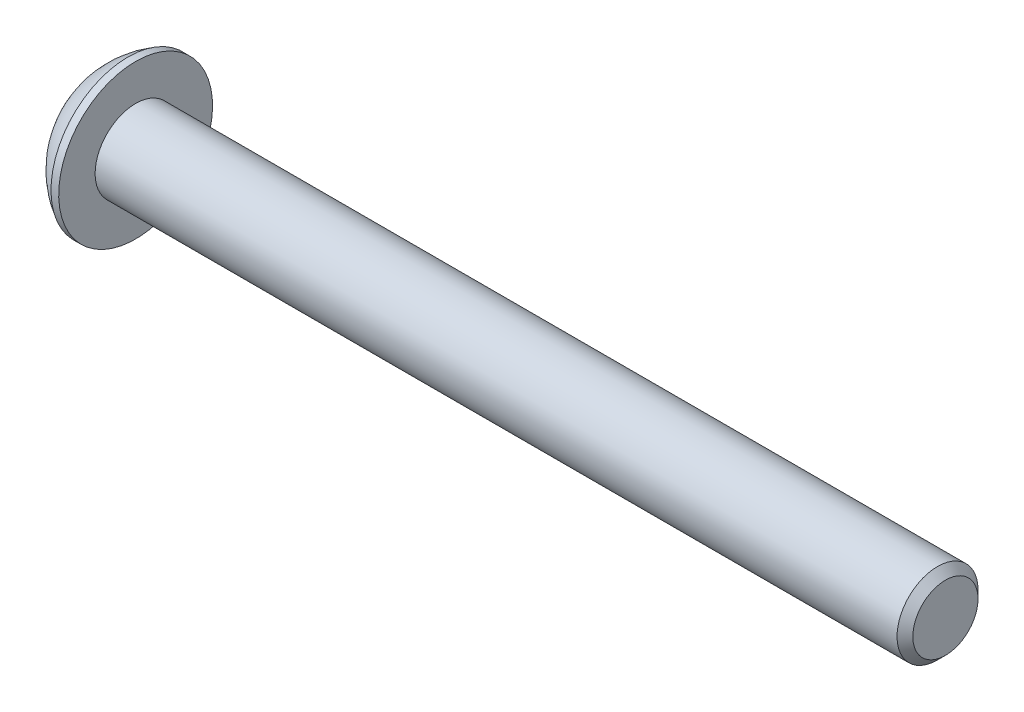
from build123d import *

# Parameters (mm, degrees)
CUT_EXTRUDE1_DEPTH = 1.5


with BuildPart() as part:
    # Sketch1 → Revolve1 (revolve)
    with BuildSketch(Plane.XY):
        with BuildLine():
            Line((42.2, 0), (42.2, 1.61))
            Line((42.2, 1.61), (41.81, 2))
            Line((41.81, 2), (2.2, 2))
            Line((2.2, 2), (2.2, 3.8))
            Line((2.2, 3.8), (1.82, 3.8))
            ThreePointArc((1.82, 3.8), (0.762013659, 2.991755338), (0, 1.9))
            Line((0, 1.9), (0, 0))
            Line((0, 0), (42.2, 0))
        make_face()
    revolve(axis=Axis((42.2, 0, 0), (-1, 0, 0)))

    # Sketch2 → Cut-Extrude1 (cut)
    with BuildSketch(Plane.ZY):
        Polygon((-1.25, 0.721687836), (-1.25, -0.721687836), (0, -1.443375673), (1.25, -0.721687836), (1.25, 0.721687836), (0, 1.443375673), align=None)
    extrude(amount=-CUT_EXTRUDE1_DEPTH, mode=Mode.SUBTRACT)


solid = part.part
